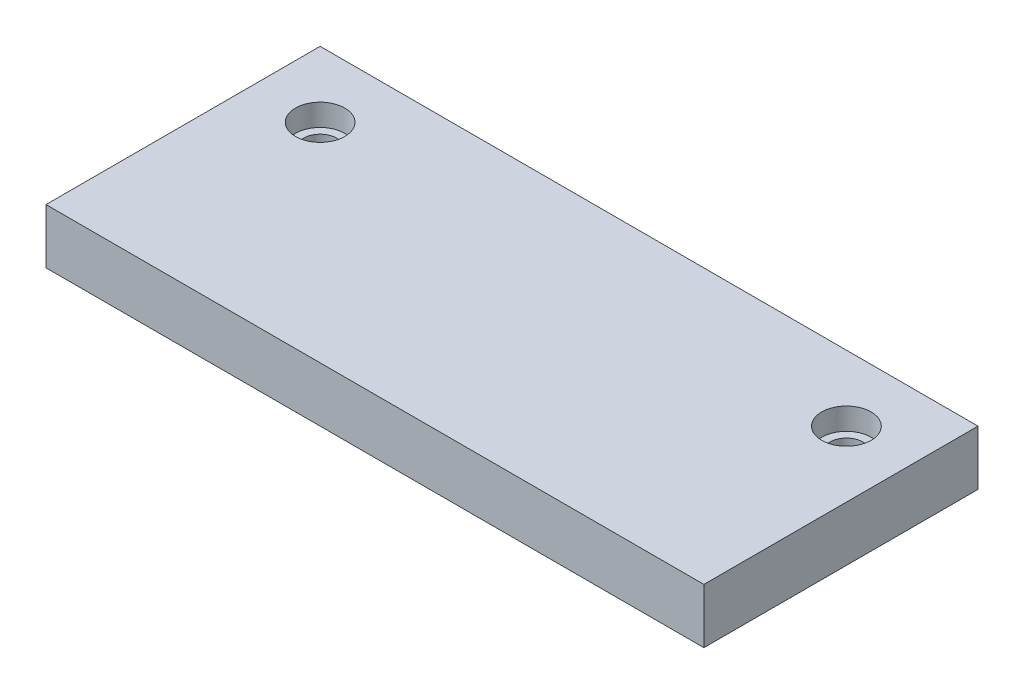
from build123d import *

# Parameters (mm, degrees)
SKETCH1_W           = 60
SKETCH1_H           = 25
SKETCH1_R           = 1.5
BOSS_EXTRUDE1_DEPTH = 5
SKETCH2_R           = 2.25
CUT_EXTRUDE1_DEPTH  = 2


with BuildPart() as part:
    # Sketch1 → Boss-Extrude1 (new body)
    with BuildSketch(Plane(origin=(0, 0, 0), x_dir=(1, 0, 0), z_dir=(0, 1, 0))):
        with Locations((30, 12.5)):
            Rectangle(SKETCH1_W, SKETCH1_H)
        with Locations(Location((6, 19, 0), (0, 0, 270))):
            Circle(SKETCH1_R, mode=Mode.SUBTRACT)
        with Locations(Location((54, 19, 0), (0, 0, 270))):
            Circle(SKETCH1_R, mode=Mode.SUBTRACT)
    extrude(amount=BOSS_EXTRUDE1_DEPTH)

    # Sketch2 → Cut-Extrude1 (cut)
    with BuildSketch(Plane(origin=(0, 5, 0), x_dir=(1, 0, 0), z_dir=(0, 1, 0))):
        with Locations(Location((6, 19, 0), (0, 0, 270))):
            Circle(SKETCH2_R)
        with Locations(Location((54, 19, 0), (0, 0, 270))):
            Circle(SKETCH2_R)
    extrude(amount=-CUT_EXTRUDE1_DEPTH, mode=Mode.SUBTRACT)


solid = part.part
